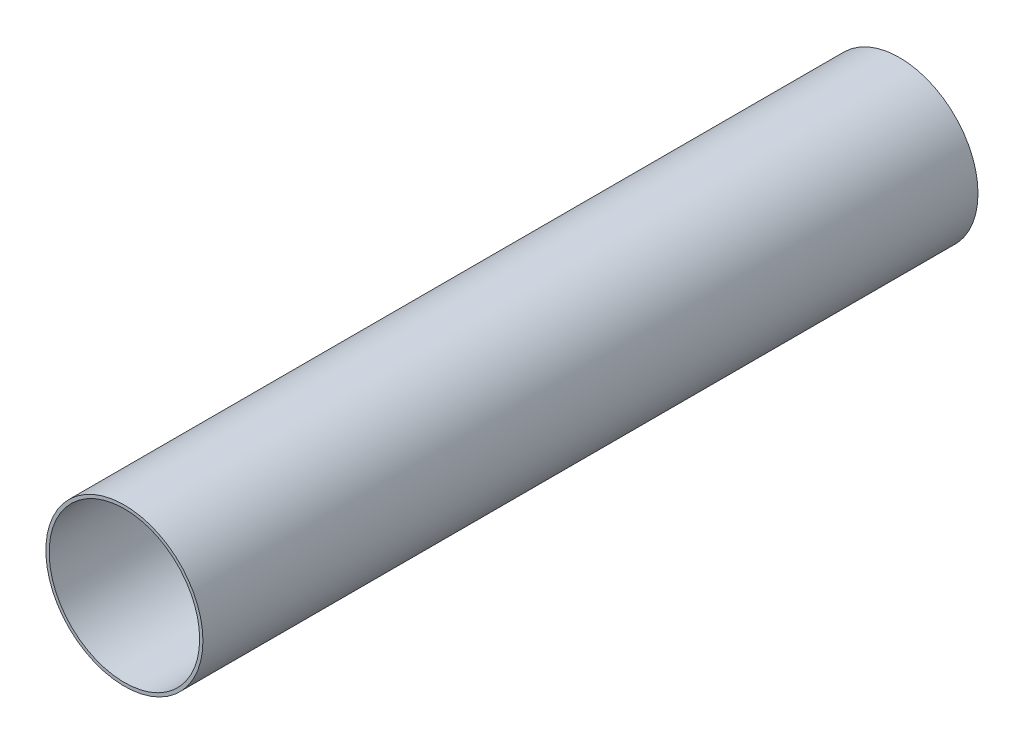
from build123d import *

# Parameters (mm, degrees)
SKETCH1_R        = 55
SKETCH1_R_2      = 52.7
EXTRUSION1_DEPTH = 542.8


with BuildPart() as part:
    # Sketch1 → Extrusion1 (new body)
    with BuildSketch(Plane.XY):
        with Locations((0.140137906, 0)):
            Circle(SKETCH1_R)
        with Locations((0.140137906, 0)):
            Circle(SKETCH1_R_2, mode=Mode.SUBTRACT)
    extrude(amount=EXTRUSION1_DEPTH)


solid = part.part
